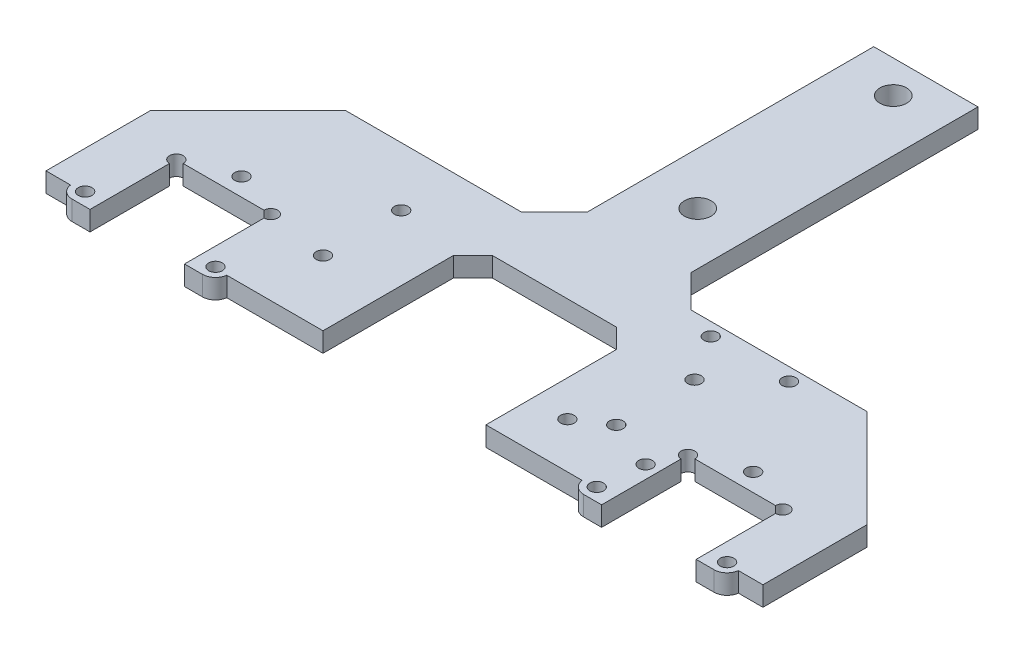
from build123d import *

# Parameters (mm, degrees)
EXTRUDE_6_DEPTH         = 3
HOLE_WIZARD_4_1_4_1_1_D = 4.1
HOLE_WIZARD_2_1_2_1_1_D = 2.1
EXTRUDE_START           = -3
SKETCH_39_R             = 1.05
EXTRUDE_7_DEPTH         = 3
HOLE_WIZARD_2_1_2_1_2_D = 2.1
CHAMFER_3_SIZE          = 3


with BuildPart() as part:
    # 草图33 → 凸台-拉伸6 (new body)
    with BuildSketch(Plane(origin=(0, 0, 0), x_dir=(1, 0, 0), z_dir=(0, 1, 0))):
        Polygon((110, 16), (110, 0), (101.5, 0), (101.5, 11.5), (87, 11.5), (87, 0), (67.5, 0), (67.5, 23), (42.5, 23), (42.5, 0), (23, 0), (23, 11.5), (8.5, 11.5), (8.5, 0), (0, 0), (0, 16), (15, 31), (42, 31), (47, 36), (47, 80), (63, 80), (63, 36), (68, 31), (95, 31), align=None)
    extrude(amount=EXTRUDE_6_DEPTH)

    # Ø4.1 (4.1) 直径孔1 (through all)
    with Locations(Plane(origin=(0, 3, 0), x_dir=(1, 0, 0), z_dir=(0, 1, 0))):
        with Locations((55, 75), (55, 45)):
            Hole(HOLE_WIZARD_4_1_4_1_1_D / 2)

    # Ø2.1 (2.1) 直径孔1 (through all)
    with Locations(Plane(origin=(0, 3, 0), x_dir=(1, 0, 0), z_dir=(0, 1, 0))):
        with Locations((32.5, 10), (5.75, 0.25), (15.75, 14.25), (25.75, 0.25), (94.25, 14.25), (104.25, 0.25), (84.25, 0.25), (73, 29), (85, 7), (73, 7), (85, 29), (32.5, 22), (77.5, 22), (77.5, 10)):
            Hole(HOLE_WIZARD_2_1_2_1_1_D / 2)

    # 草图39 → 凸台-拉伸7 (add)
    # profile 1 of 4: a face of its own
    with BuildSketch(Plane(origin=(0, 3, 0), x_dir=(1, 0, 0), z_dir=(0, 1, 0)).offset(EXTRUDE_START)):
        with BuildLine():
            Line((5.75, -1.75), (8.5, -1.75))
            Line((8.5, -1.75), (8.5, 0))
            Line((8.5, 0), (7.734313483, 0))
            ThreePointArc((7.734313483, 0), (4.427124344, 1.75), (5.75, -1.75))
        make_face()
        with Locations(Location((5.75, 0.25, 0), (0, 0, 270))):
            Circle(SKETCH_39_R, mode=Mode.SUBTRACT)
    # profile 2 of 4: a face of its own
    with BuildSketch(Plane(origin=(0, 3, 0), x_dir=(1, 0, 0), z_dir=(0, 1, 0)).offset(EXTRUDE_START)):
        with BuildLine():
            Line((25.75, -1.75), (23, -1.75))
            Line((23, -1.75), (23, 0))
            Line((23, 0), (23.765686517, 0))
            ThreePointArc((23.765686517, 0), (27.072875656, 1.75), (25.75, -1.75))
        make_face()
        with Locations(Location((25.75, 0.25, 0), (0, 0, 270))):
            Circle(SKETCH_39_R, mode=Mode.SUBTRACT)
    # profile 3 of 4: a face of its own
    with BuildSketch(Plane(origin=(0, 3, 0), x_dir=(1, 0, 0), z_dir=(0, 1, 0)).offset(EXTRUDE_START)):
        with BuildLine():
            Line((101.5, 0), (102.265686517, 0))
            ThreePointArc((102.265686517, 0), (105.572875656, 1.75), (104.25, -1.75))
            Line((104.25, -1.75), (101.5, -1.75))
            Line((101.5, -1.75), (101.5, 0))
        make_face()
        with Locations(Location((104.25, 0.25, 0), (0, 0, 270))):
            Circle(SKETCH_39_R, mode=Mode.SUBTRACT)
    # profile 4 of 4: a face of its own
    with BuildSketch(Plane(origin=(0, 3, 0), x_dir=(1, 0, 0), z_dir=(0, 1, 0)).offset(EXTRUDE_START)):
        with BuildLine():
            Line((84.25, -1.75), (87, -1.75))
            Line((87, -1.75), (87, 0))
            Line((87, 0), (86.234313483, 0))
            ThreePointArc((86.234313483, 0), (82.927124344, 1.75), (84.25, -1.75))
        make_face()
        with Locations(Location((84.25, 0.25, 0), (0, 0, 270))):
            Circle(SKETCH_39_R, mode=Mode.SUBTRACT)
    extrude(amount=EXTRUDE_7_DEPTH)

    # Ø2.1 (2.1) 直径孔2 (through all)
    with Locations(Plane(origin=(0, 3, 0), x_dir=(1, 0, 0), z_dir=(0, 1, 0))):
        with Locations((8.5, 11.5), (23, 11.5), (87, 11.5), (101.5, 11.5)):
            Hole(HOLE_WIZARD_2_1_2_1_2_D / 2)

    # 倒角3
    chamfer_3_edges = [part.edges().sort_by_distance(p)[0] for p in [
        (67.5, 1.5, -23),
        (42.5, 1.5, -23),
    ]]
    chamfer(chamfer_3_edges, length=CHAMFER_3_SIZE)


solid = part.part
